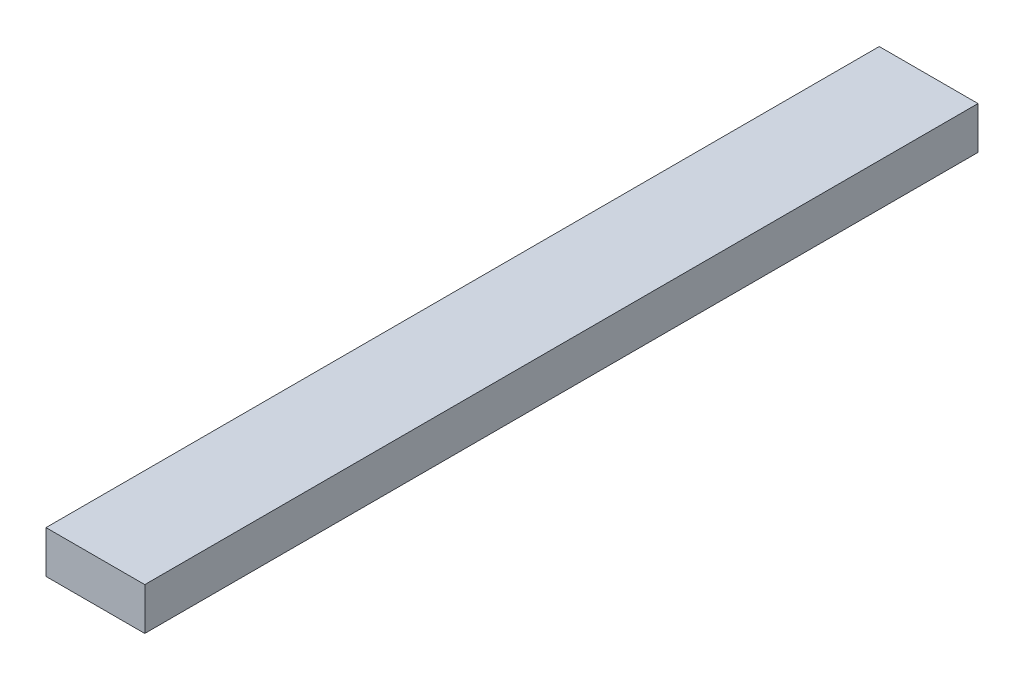
from build123d import *

# Parameters (mm, degrees)
SKETCH1_W           = 88.9
SKETCH1_H           = 38.1
BOSS_EXTRUDE1_DEPTH = 750


with BuildPart() as part:
    # Sketch1 → Boss-Extrude1 (new body)
    with BuildSketch(Plane.XY):
        Rectangle(SKETCH1_W, SKETCH1_H)
    extrude(amount=BOSS_EXTRUDE1_DEPTH)


solid = part.part
